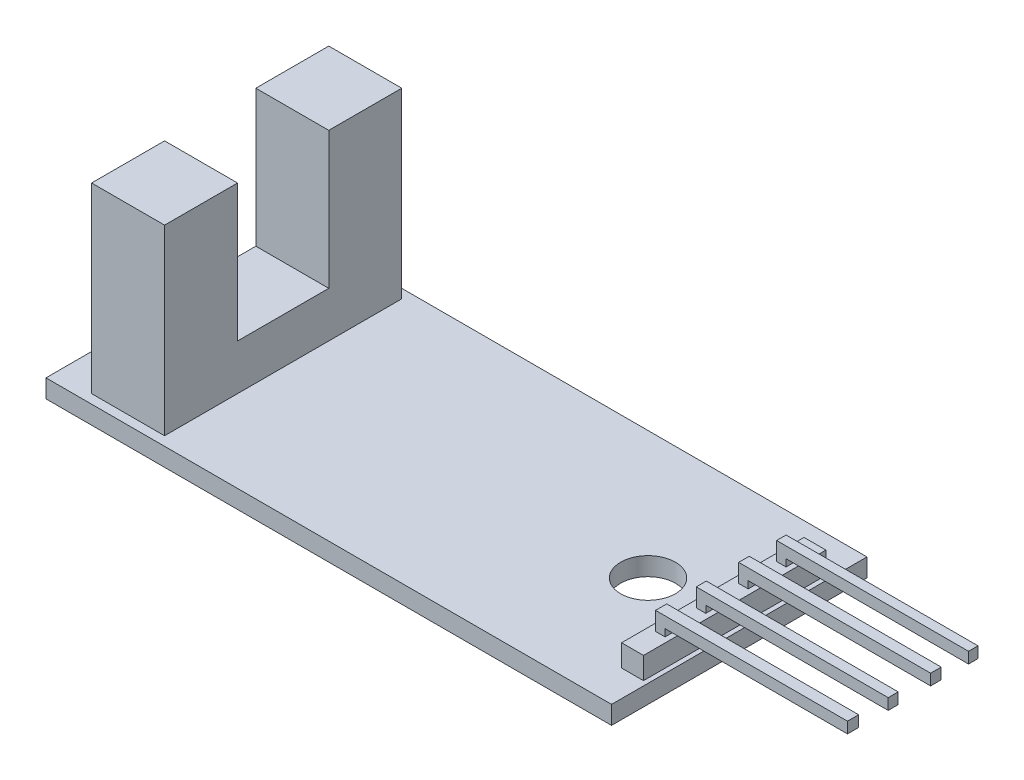
from build123d import *

# Parameters (mm, degrees)
SKETCH1_W           = 31
SKETCH1_H           = 14
BOSS_EXTRUDE1_DEPTH = 1
SKETCH2_W           = 4
SKETCH2_H           = 4
BOSS_EXTRUDE2_DEPTH = 10
SKETCH3_R           = 1.5
CUT_EXTRUDE1_DEPTH  = 36.454195802
SKETCH4_W           = 4
SKETCH4_H           = 5
BOSS_EXTRUDE3_DEPTH = 2.5
SKETCH_1_W          = 1.2
SKETCH_1_H          = 10
EXTRUDE_1_DEPTH     = 1.2
SKETCH_2_W          = 0.519767639
SKETCH_2_H          = 0.519767639
SKETCH_2_H_2        = 0.580916774
SKETCH_2_H_3        = 0.550342206
SKETCH_2_H_4        = 0.61149134
EXTRUDE_2_DEPTH     = 1
SKETCH_3_W          = 0.61149134
SKETCH_3_H          = 0.60685635
SKETCH_3_W_2        = 0.550342206
SKETCH_3_W_3        = 0.580916774
SKETCH_3_W_4        = 0.519767639
EXTRUDE_3_DEPTH     = 10


with BuildPart() as part:
    # Sketch1 → Boss-Extrude1 (new body)
    with BuildSketch(Plane(origin=(0, 0, 0), x_dir=(1, 0, 0), z_dir=(0, 1, 0))):
        with Locations((15.5, -7)):
            Rectangle(SKETCH1_W, SKETCH1_H)
    extrude(amount=BOSS_EXTRUDE1_DEPTH)

    # Sketch2 → Boss-Extrude2 (add)
    with BuildSketch(Plane(origin=(0, 1, 0), x_dir=(1, 0, 0), z_dir=(0, 1, 0))):
        with Locations((4, -11.5)):
            Rectangle(SKETCH2_W, SKETCH2_H)
        with Locations((4, -2.5)):
            Rectangle(SKETCH2_W, SKETCH2_H)
    extrude(amount=BOSS_EXTRUDE2_DEPTH)

    # Sketch3 → Cut-Extrude1 (cut, through all)
    with BuildSketch(Plane(origin=(0, 1, 0), x_dir=(1, 0, 0), z_dir=(0, 1, 0))):
        with Locations(Location((26, -7, 0), (0, 0, 270))):
            Circle(SKETCH3_R)
    extrude(amount=-CUT_EXTRUDE1_DEPTH, mode=Mode.SUBTRACT)

    # Sketch4 → Boss-Extrude3 (add)
    with BuildSketch(Plane(origin=(0, 1, 0), x_dir=(1, 0, 0), z_dir=(0, 1, 0))):
        with Locations((4, -7)):
            Rectangle(SKETCH4_W, SKETCH4_H)
    extrude(amount=BOSS_EXTRUDE3_DEPTH)

    # 草图1 → 凸台-拉伸1 (add)
    with BuildSketch(Plane(origin=(0, 1, 0), x_dir=(1, 0, 0), z_dir=(0, 1, 0))):
        with Locations((30.150896117, -7)):
            Rectangle(SKETCH_1_W, SKETCH_1_H)
    extrude(amount=EXTRUDE_1_DEPTH)

    # 草图2 → 凸台-拉伸2 (add)
    with BuildSketch(Plane(origin=(0, 2.2, 0), x_dir=(1, 0, 0), z_dir=(0, 1, 0))):
        with Locations((30.20363542, -3.636797628)):
            Rectangle(SKETCH_2_W, SKETCH_2_H)
        with Locations((30.20363542, -5.685293618)):
            Rectangle(SKETCH_2_W, SKETCH_2_H_2)
        with Locations((30.20363542, -8.024247995)):
            Rectangle(SKETCH_2_W, SKETCH_2_H_3)
        with Locations((30.20363542, -10.225616821)):
            Rectangle(SKETCH_2_W, SKETCH_2_H_4)
    extrude(amount=EXTRUDE_2_DEPTH)

    # 草图3 → 凸台-拉伸3 (add)
    with BuildSketch(Plane(origin=(30.463519239, 0, 0), x_dir=(0, 0, -1), z_dir=(1, 0, 0))):
        with Locations((-10.225616821, 2.896571825)):
            Rectangle(SKETCH_3_W, SKETCH_3_H)
        with Locations((-8.024247995, 2.896571825)):
            Rectangle(SKETCH_3_W_2, SKETCH_3_H)
        with Locations((-5.685293618, 2.896571825)):
            Rectangle(SKETCH_3_W_3, SKETCH_3_H)
        with Locations((-3.636797628, 2.896571825)):
            Rectangle(SKETCH_3_W_4, SKETCH_3_H)
    extrude(amount=EXTRUDE_3_DEPTH)


solid = part.part
